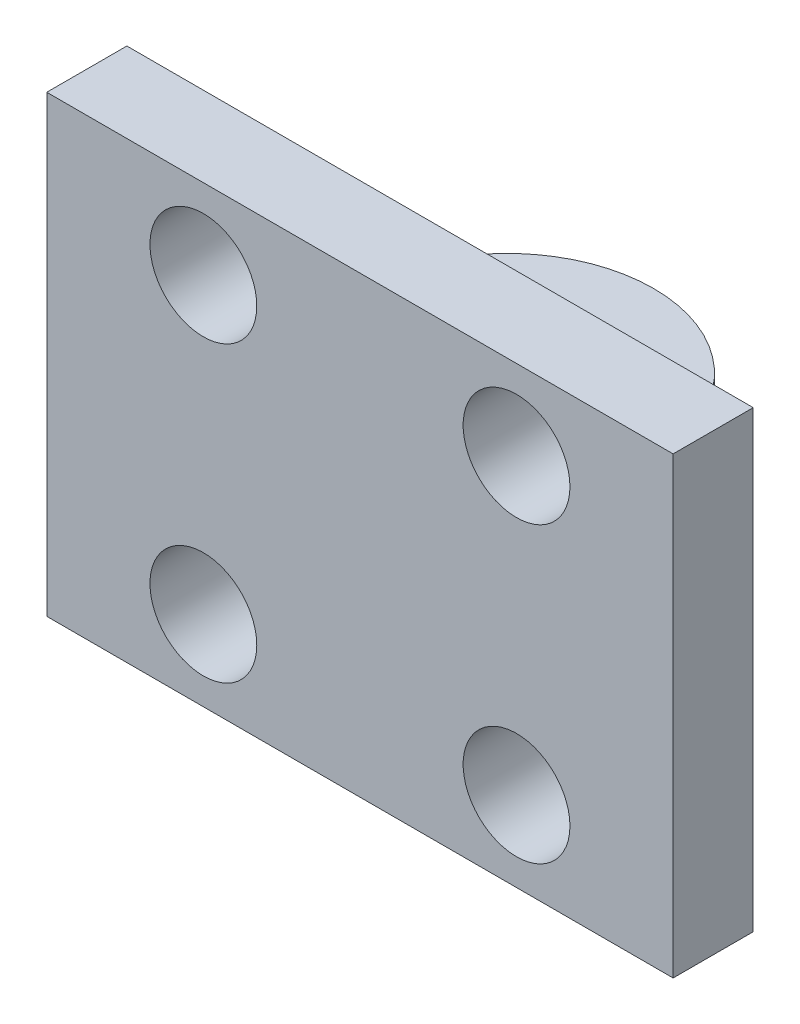
from build123d import *

# Parameters (mm, degrees)
BOSS_EXTRUDE1_DEPTH = 5
SKETCH2_R           = 2
CUT_EXTRUDE1_DEPTH  = 5
SKETCH5_W           = 10
SKETCH5_H           = 5
CUT_EXTRUDE2_DEPTH  = 5
SKETCH6_R           = 2
BOSS_EXTRUDE4_DEPTH = 3


with BuildPart() as part:
    # Sketch1 → Boss-Extrude1 (new body)
    # profile 1 of 9: a face of its own
    with BuildSketch(Plane(origin=(0, 0, 0), x_dir=(1, 0, 0), z_dir=(0, 1, 0))):
        with BuildLine():
            ThreePointArc((4.898979486, -2.5), (5.347634392, -1.285615189), (5.5, 0))
            ThreePointArc((5.5, 0), (0, 5.5), (-5.5, 0))
            ThreePointArc((-5.5, 0), (-5.347634392, -1.285615189), (-4.898979486, -2.5))
            Line((-4.898979486, -2.5), (0, -2.5))
            Line((0, -2.5), (4.898979486, -2.5))
        make_face()
        with BuildLine():
            ThreePointArc((2.5, 0), (1.767766953, -1.767766953), (0, -2.5))
            ThreePointArc((0, -2.5), (-1.767766953, 1.767766953), (2.5, 0))
        make_face(mode=Mode.SUBTRACT)
    # profile 2 of 9: a face of its own
    with BuildSketch(Plane(origin=(0, 0, 0), x_dir=(1, 0, 0), z_dir=(0, 1, 0))):
        with BuildLine():
            ThreePointArc((0, -5.5), (2.872281323, -4.69041576), (4.898979486, -2.5))
            Line((4.898979486, -2.5), (0, -2.5))
            Line((0, -2.5), (0, -5.5))
        make_face()
    # profile 3 of 9: a face of its own
    with BuildSketch(Plane(origin=(0, 0, 0), x_dir=(1, 0, 0), z_dir=(0, 1, 0))):
        with BuildLine():
            Line((0, -2.5), (-4.898979486, -2.5))
            ThreePointArc((-4.898979486, -2.5), (-2.872281323, -4.69041576), (0, -5.5))
            Line((0, -5.5), (0, -2.5))
        make_face()
    # profile 4 of 9: a face of its own
    with BuildSketch(Plane(origin=(0, 0, 0), x_dir=(1, 0, 0), z_dir=(0, 1, 0))):
        with BuildLine():
            Line((25.742031851, -2.5), (11.729658022, -2.5))
            Line((11.729658022, -2.5), (4.898979486, -2.5))
            ThreePointArc((4.898979486, -2.5), (2.872281323, -4.69041576), (0, -5.5))
            Line((0, -5.5), (25.742031851, -5.5))
            Line((25.742031851, -5.5), (25.742031851, -2.5))
        make_face()
    # profile 5 of 9: a face of its own
    with BuildSketch(Plane(origin=(0, 0, 0), x_dir=(1, 0, 0), z_dir=(0, 1, 0))):
        with BuildLine():
            Line((11.729658022, -2.5), (5.5, 0))
            ThreePointArc((5.5, 0), (5.347634392, -1.285615189), (4.898979486, -2.5))
            Line((4.898979486, -2.5), (11.729658022, -2.5))
        make_face()
    # profile 6 of 9: a face of its own
    with BuildSketch(Plane(origin=(0, 0, 0), x_dir=(1, 0, 0), z_dir=(0, 1, 0))):
        with BuildLine():
            ThreePointArc((0, -5.5), (2.872281323, -4.69041576), (4.898979486, -2.5))
            Line((4.898979486, -2.5), (0, -2.5))
            Line((0, -2.5), (0, -5.5))
        make_face()
    # profile 7 of 9: a face of its own
    with BuildSketch(Plane(origin=(0, 0, 0), x_dir=(1, 0, 0), z_dir=(0, 1, 0))):
        with BuildLine():
            Line((0, -2.5), (-4.898979486, -2.5))
            ThreePointArc((-4.898979486, -2.5), (-2.872281323, -4.69041576), (0, -5.5))
            Line((0, -5.5), (0, -2.5))
        make_face()
    # profile 8 of 9: a face of its own
    with BuildSketch(Plane(origin=(0, 0, 0), x_dir=(1, 0, 0), z_dir=(0, 1, 0))):
        with BuildLine():
            ThreePointArc((-4.898979486, -2.5), (-5.347634392, -1.285615189), (-5.5, 0))
            Line((-5.5, 0), (-11.729658022, -2.5))
            Line((-11.729658022, -2.5), (-4.898979486, -2.5))
        make_face()
    # profile 9 of 9: a face of its own
    with BuildSketch(Plane(origin=(0, 0, 0), x_dir=(1, 0, 0), z_dir=(0, 1, 0))):
        with BuildLine():
            Line((-4.898979486, -2.5), (-11.729658022, -2.5))
            Line((-11.729658022, -2.5), (-25.742031851, -2.5))
            Line((-25.742031851, -2.5), (-25.742031851, -5.5))
            Line((-25.742031851, -5.5), (0, -5.5))
            ThreePointArc((0, -5.5), (-2.872281323, -4.69041576), (-4.898979486, -2.5))
        make_face()
    extrude(amount=BOSS_EXTRUDE1_DEPTH)

    # Sketch2 → Cut-Extrude1 (cut)
    with BuildSketch(Plane(origin=(0, 0, 2.5), x_dir=(-1, 0, 0), z_dir=(0, 0, -1))):
        Polygon((-25.742031851, 0), (-21.729658022, 0), (-21.729658022, 2.5), (-21.729658022, 5), (-25.742031851, 5), align=None)
        Polygon((21.729658022, 2.5), (21.729658022, 0), (25.742031851, 0), (25.742031851, 5), (21.729658022, 5), align=None)
        with Locations((16.729658022, 2.5)):
            Circle(SKETCH2_R)
        with Locations((-16.729658022, 2.5)):
            Circle(SKETCH2_R)
    extrude(amount=-CUT_EXTRUDE1_DEPTH, mode=Mode.SUBTRACT)

    # Sketch5 → Cut-Extrude2 (cut)
    with BuildSketch(Plane(origin=(0, 0, 2.5), x_dir=(-1, 0, 0), z_dir=(0, 0, -1))):
        with Locations((-16.729658022, 2.5)):
            Rectangle(SKETCH5_W, SKETCH5_H)
        with Locations((16.729658022, 2.5)):
            Rectangle(SKETCH5_W, SKETCH5_H)
    extrude(amount=-CUT_EXTRUDE2_DEPTH, mode=Mode.SUBTRACT)

    # Sketch6 → Boss-Extrude4 (add)
    # profile 1 of 6: a face of its own
    with BuildSketch(Plane.XY.offset(5.5)):
        Polygon((11.729658022, 11), (0, 11), (0, 8), (0, 5), (11.729658022, 5), align=None)
        with Locations((5.864829011, 8)):
            Circle(SKETCH6_R, mode=Mode.SUBTRACT)
    # profile 2 of 6: a face of its own
    with BuildSketch(Plane.XY.offset(5.5)):
        Polygon((0, 0), (0, -3), (0, -6), (11.729658022, -6), (11.729658022, 0), align=None)
        with Locations((5.864829011, -3)):
            Circle(SKETCH6_R, mode=Mode.SUBTRACT)
    # profile 3 of 6: a face of its own
    with BuildSketch(Plane.XY.offset(5.5)):
        with BuildLine():
            Line((0, 5), (0, 8))
            Line((0, 8), (-3.864829011, 8))
            ThreePointArc((-3.864829011, 8), (-5.864829011, 6), (-7.864829011, 8))
            Line((-7.864829011, 8), (-11.729658022, 8))
            Line((-11.729658022, 8), (-11.729658022, 5))
            Line((-11.729658022, 5), (0, 5))
        make_face()
    # profile 4 of 6: a face of its own
    with BuildSketch(Plane.XY.offset(5.5)):
        with BuildLine():
            Line((0, 8), (0, 11))
            Line((0, 11), (-11.729658022, 11))
            Line((-11.729658022, 11), (-11.729658022, 8))
            Line((-11.729658022, 8), (-7.864829011, 8))
            ThreePointArc((-7.864829011, 8), (-5.864829011, 10), (-3.864829011, 8))
            Line((-3.864829011, 8), (0, 8))
        make_face()
    # profile 5 of 6: a face of its own
    with BuildSketch(Plane.XY.offset(5.5)):
        with BuildLine():
            ThreePointArc((-7.864829011, -3), (-5.864829011, -1), (-3.864829011, -3))
            Line((-3.864829011, -3), (0, -3))
            Line((0, -3), (0, 0))
            Line((0, 0), (-11.729658022, 0))
            Line((-11.729658022, 0), (-11.729658022, -3))
            Line((-11.729658022, -3), (-7.864829011, -3))
        make_face()
    # profile 6 of 6: a face of its own
    with BuildSketch(Plane.XY.offset(5.5)):
        with BuildLine():
            Line((0, -3), (-3.864829011, -3))
            ThreePointArc((-3.864829011, -3), (-5.864829011, -5), (-7.864829011, -3))
            Line((-7.864829011, -3), (-11.729658022, -3))
            Line((-11.729658022, -3), (-11.729658022, -6))
            Line((-11.729658022, -6), (0, -6))
            Line((0, -6), (0, -3))
        make_face()
    extrude(amount=-BOSS_EXTRUDE4_DEPTH)


solid = part.part
